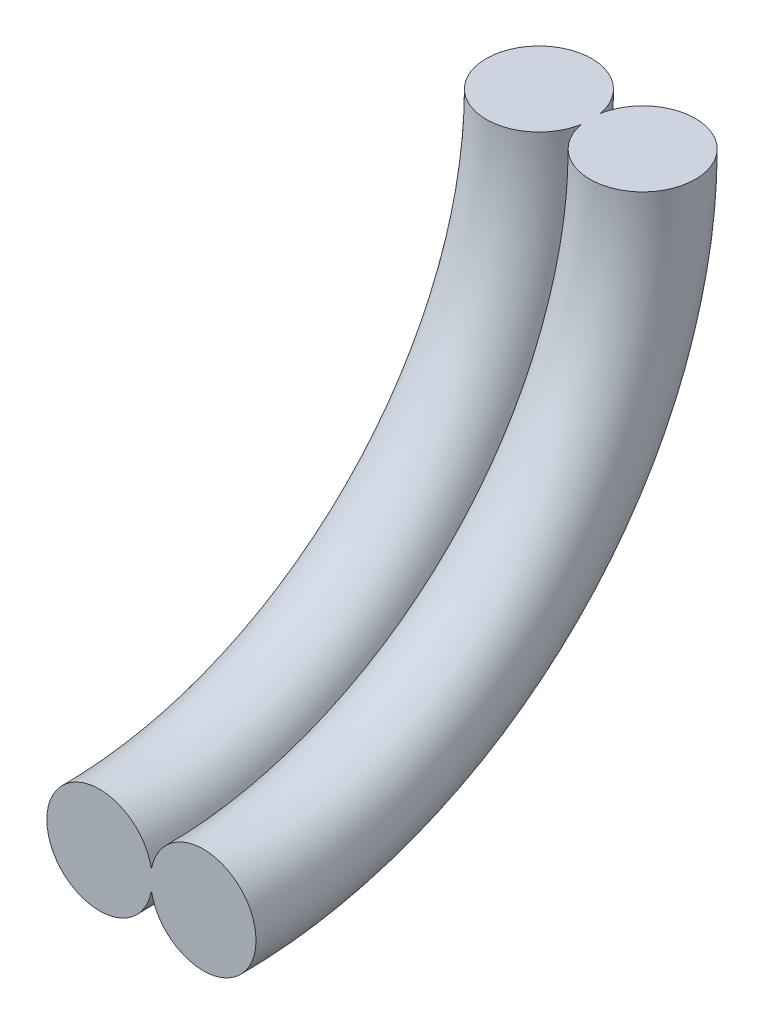
from build123d import *

# Parameters (mm, degrees)
SKETCH1_R = 0.762


with BuildPart() as part:
    # Sweep2: sweep along a path in Sketch3
    with BuildLine(Plane(origin=(0.2794, 0, 0), x_dir=(0, 0, -1), z_dir=(1, 0, 0))) as sweep2_path:
        ThreePointArc((0, 0), (-1.859871939, -4.490128061), (-6.35, -6.35))
    # Sketch1 → Sweep2 (sweep)
    with BuildSketch(Plane(origin=(0, 0, 0), x_dir=(1, 0, 0), z_dir=(0, 1, 0))):
        with Locations((0.7493, 0)):
            Circle(SKETCH1_R)
    sweep2 = sweep(path=sweep2_path.line)

    # Mirror4: Sweep2 across plane
    add(sweep2.mirror(Plane(origin=(0, 0, 0), x_dir=(0, 0, 1), z_dir=(1, 0, 0))))


solid = part.part
